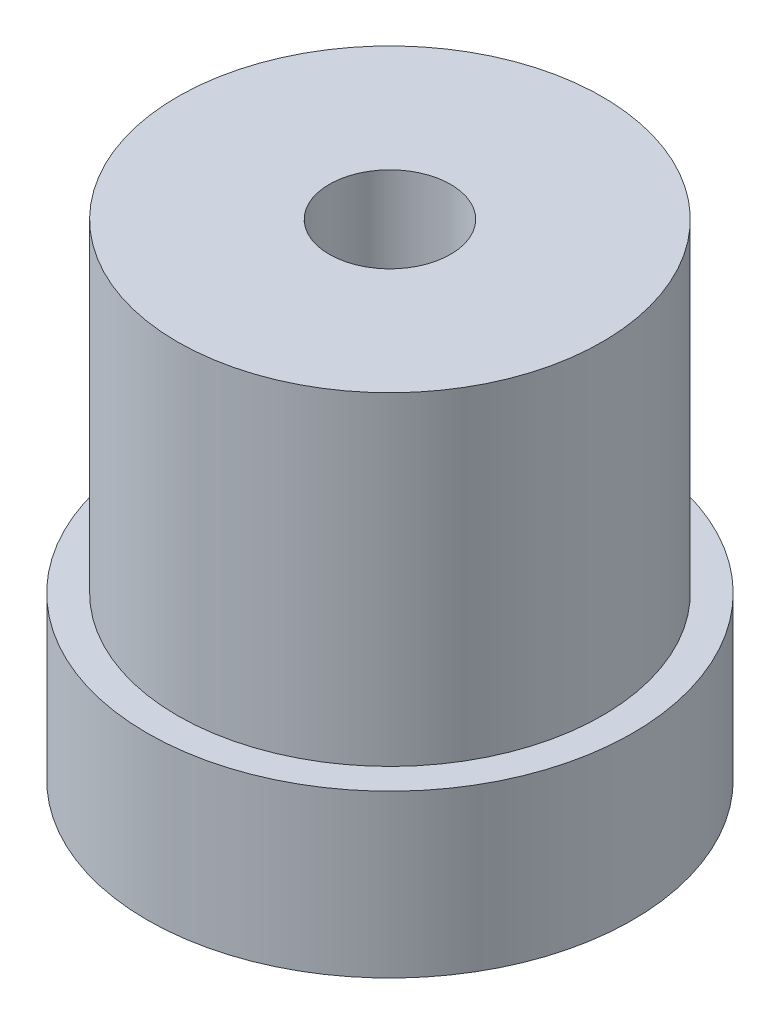
from build123d import *

# Parameters (mm, degrees)
SKETCH1_R           = 76.2
BOSS_EXTRUDE1_DEPTH = 50.8
SKETCH2_R           = 66.675
BOSS_EXTRUDE2_DEPTH = 101.6
SKETCH3_R           = 19.05
CUT_EXTRUDE1_DEPTH  = 38.1


with BuildPart() as part:
    # Sketch1 → Boss-Extrude1 (new body)
    with BuildSketch(Plane(origin=(0, 0, 0), x_dir=(1, 0, 0), z_dir=(0, 1, 0))):
        Circle(SKETCH1_R)
    extrude(amount=BOSS_EXTRUDE1_DEPTH)

    # Sketch2 → Boss-Extrude2 (add)
    with BuildSketch(Plane(origin=(0, 50.8, 0), x_dir=(1, 0, 0), z_dir=(0, 1, 0))):
        Circle(SKETCH2_R)
    extrude(amount=BOSS_EXTRUDE2_DEPTH)

    # Sketch3 → Cut-Extrude1 (cut)
    with BuildSketch(Plane(origin=(0, 152.4, 0), x_dir=(1, 0, 0), z_dir=(0, 1, 0))):
        Circle(SKETCH3_R)
    extrude(amount=-CUT_EXTRUDE1_DEPTH, mode=Mode.SUBTRACT)


solid = part.part
